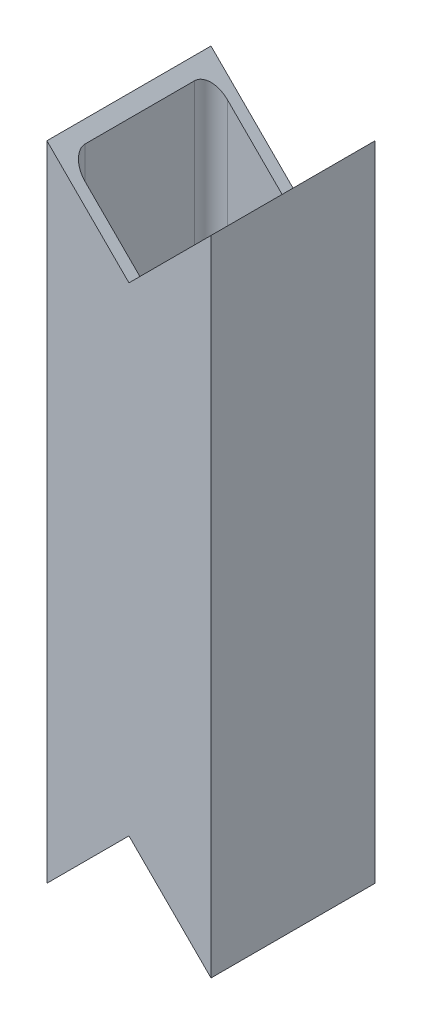
from build123d import *

# Parameters (mm, degrees)
BOSS_EXTRU_1_DEPTH      = 30
ENL_V_MAT_EXTRU_1_DEPTH = 171


with BuildPart() as part:
    # Esquisse1 → Boss.-Extru.1 (new body)
    with BuildSketch(Plane.XY):
        Polygon((0, 0), (0, 117.56958174), (15, 102.56958174), (30, 117.56958174), (30, 0), (15, 15), align=None)
    extrude(amount=BOSS_EXTRU_1_DEPTH)

    # Esquisse2 → Enlèv. mat.-Extru.1 (cut)
    with BuildSketch(Plane(origin=(0, 0, 0), x_dir=(1, 0, 0), z_dir=(0, 1, 0))):
        with BuildLine():
            Line((5, -28), (25, -28))
            ThreePointArc((25, -28), (27.121320344, -27.121320344), (28, -25))
            Line((28, -25), (28, -5))
            ThreePointArc((28, -5), (27.121320344, -2.878679656), (25, -2))
            Line((25, -2), (5, -2))
            ThreePointArc((5, -2), (2.878679656, -2.878679656), (2, -5))
            Line((2, -5), (2, -25))
            ThreePointArc((2, -25), (2.878679656, -27.121320344), (5, -28))
        make_face()
    extrude(amount=ENL_V_MAT_EXTRU_1_DEPTH, mode=Mode.SUBTRACT)


solid = part.part
